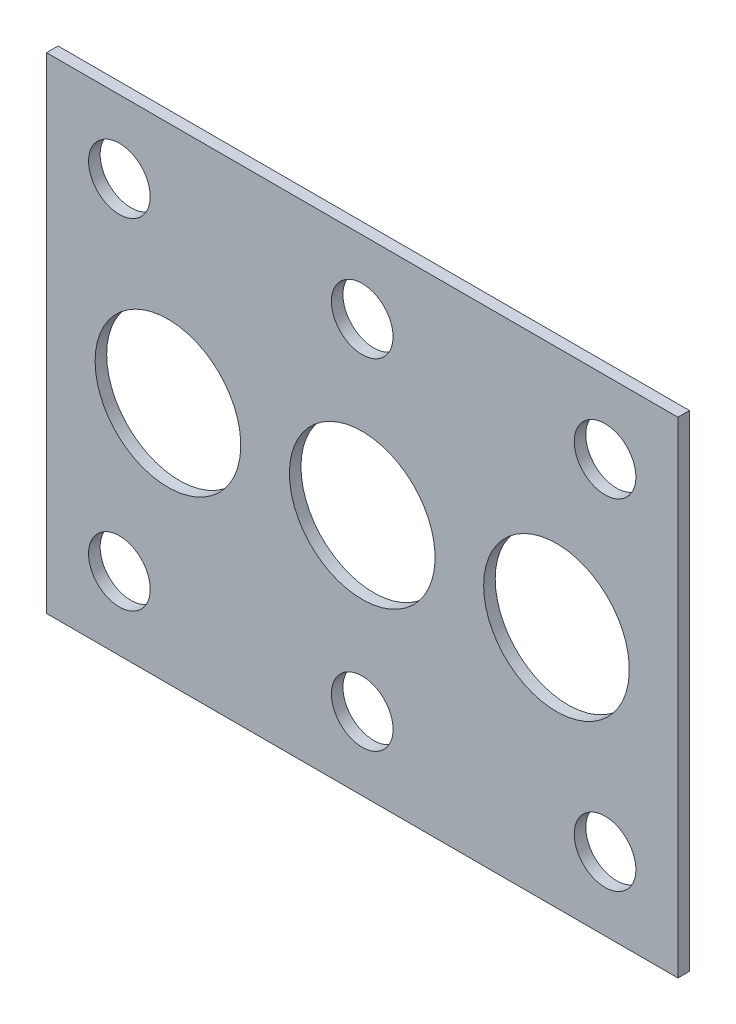
from build123d import *

# Parameters (mm, degrees)
ESBO_O1_W                = 260
ESBO_O1_H                = 200
ESBO_O1_R                = 12.7
ESBO_O1_R_2              = 30
RESSALTO_EXTRUS_O1_DEPTH = 4.7625


with BuildPart() as part:
    # Esboço1 → Ressalto-extrusão1 (new body)
    with BuildSketch(Plane.XY):
        with Locations((-100, 70)):
            Rectangle(ESBO_O1_W, ESBO_O1_H)
        with Locations(Location((0, 0, 0), (0, 0, 180))):
            Circle(ESBO_O1_R, mode=Mode.SUBTRACT)
        with Locations(Location((-100, 0, 0), (0, 0, 180))):
            Circle(ESBO_O1_R, mode=Mode.SUBTRACT)
        with Locations(Location((-200, 0, 0), (0, 0, 180))):
            Circle(ESBO_O1_R, mode=Mode.SUBTRACT)
        with Locations(Location((-200, 140, 0), (0, 0, 180))):
            Circle(ESBO_O1_R, mode=Mode.SUBTRACT)
        with Locations(Location((-100, 140, 0), (0, 0, 180))):
            Circle(ESBO_O1_R, mode=Mode.SUBTRACT)
        with Locations(Location((0, 140, 0), (0, 0, 180))):
            Circle(ESBO_O1_R, mode=Mode.SUBTRACT)
        with Locations(Location((-100, 70, 0), (0, 0, 180))):
            Circle(ESBO_O1_R_2, mode=Mode.SUBTRACT)
        with Locations(Location((-20, 70, 0), (0, 0, 180))):
            Circle(ESBO_O1_R_2, mode=Mode.SUBTRACT)
        with Locations(Location((-180, 70, 0), (0, 0, 180))):
            Circle(ESBO_O1_R_2, mode=Mode.SUBTRACT)
    extrude(amount=RESSALTO_EXTRUS_O1_DEPTH)


solid = part.part
